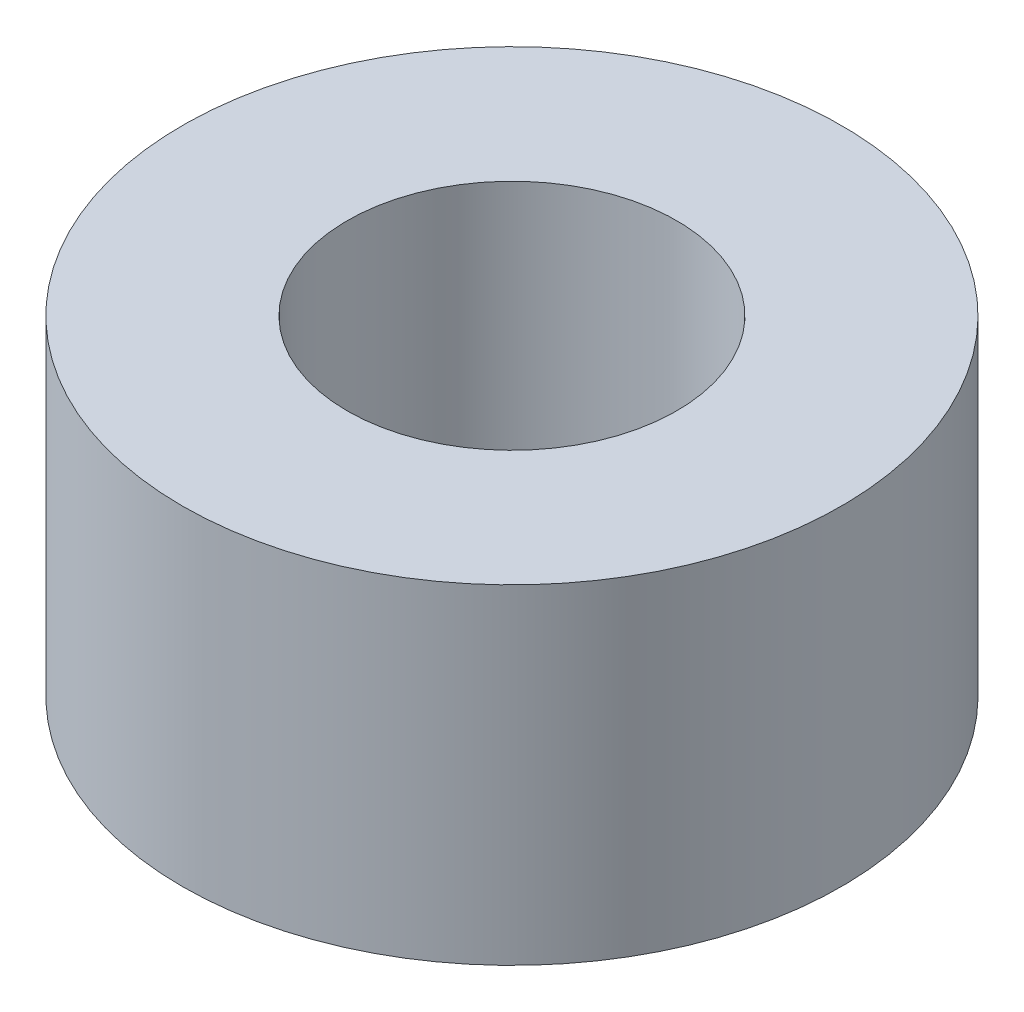
from build123d import *

# Parameters (mm, degrees)
SKETCH1_R       = 6.35
SKETCH1_R_2     = 3.175
THICKNESS_DEPTH = 6.35


with BuildPart() as part:
    # Sketch1 → Thickness (new body)
    with BuildSketch(Plane(origin=(0, 0, 0), x_dir=(1, 0, 0), z_dir=(0, 1, 0))):
        with Locations(Location((0, 0, 0), (0, 0, 270))):
            Circle(SKETCH1_R)
        with Locations(Location((0, 0, 0), (0, 0, 270))):
            Circle(SKETCH1_R_2, mode=Mode.SUBTRACT)
    extrude(amount=THICKNESS_DEPTH)


solid = part.part
